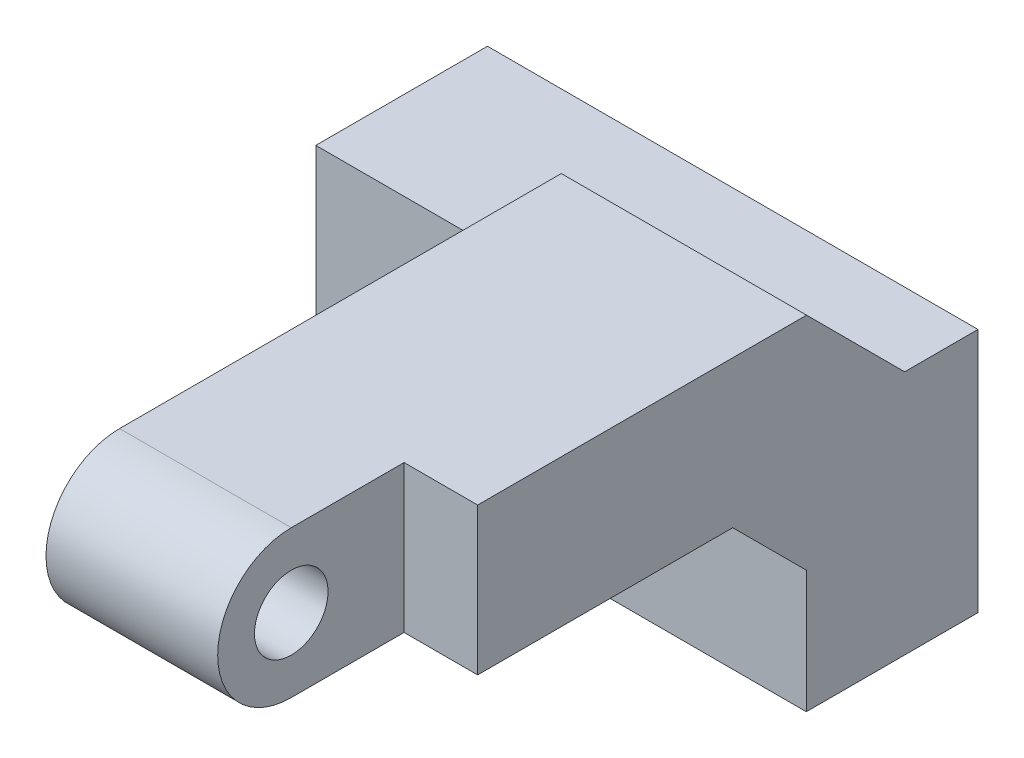
from build123d import *

# Parameters (mm, degrees)
ESQUISSE1_W                  = 20
ESQUISSE1_H                  = 7
BOSS_EXTRU_1_DEPTH           = 10
BOSS_EXTRU_2_DEPTH           = 10
ESQUISSE3_W                  = 3
ESQUISSE3_H                  = 9.2
ENL_V_MAT_EXTRU_1_DEPTH      = 30.93743476
ESQUISSE4_R                  = 1.5
ENL_V_MAT_EXTRU_2_DEPTH      = 30.93743476
ENL_V_MAT_EXTRU_4_DEPTH      = 28.147743921
ENL_V_MAT_EXTRU_4_DEPTH_BACK = 28.147743921
ESQUISSE7_R                  = 1.5
ENL_V_MAT_EXTRU_3_DEPTH      = 28.147743921
ENL_V_MAT_EXTRU_3_DEPTH_BACK = 3.5


with BuildPart() as part:
    # Esquisse1 → Boss.-Extru.1 (new body)
    with BuildSketch(Plane(origin=(0, 0, 0), x_dir=(1, 0, 0), z_dir=(0, 1, 0))):
        Rectangle(ESQUISSE1_W, ESQUISSE1_H)
    extrude(amount=BOSS_EXTRU_1_DEPTH)

    # Esquisse2 → Boss.-Extru.2 (add)
    with BuildSketch(Plane(origin=(0, 0, 0), x_dir=(0, 0, -1), z_dir=(1, 0, 0))):
        with BuildLine():
            Line((-3.5, 5), (-3.5, 10))
            Line((-3.5, 10), (0.510302645, 10))
            Line((0.510302645, 10), (-3.489697355, 14))
            Line((-3.489697355, 14), (-21.5, 14))
            ThreePointArc((-21.5, 14), (-24.5, 11), (-21.5, 8))
            Line((-21.5, 8), (-6.5, 8))
            Line((-6.5, 8), (-3.5, 5))
        make_face()
    extrude(amount=BOSS_EXTRU_2_DEPTH)

    # Esquisse3 → Enlèv. mat.-Extru.1 (cut, through all)
    with BuildSketch(Plane(origin=(0, 14, 0), x_dir=(1, 0, 0), z_dir=(0, 1, 0))):
        with Locations((8.5, -21.5)):
            Rectangle(ESQUISSE3_W, ESQUISSE3_H)
    extrude(amount=-ENL_V_MAT_EXTRU_1_DEPTH, mode=Mode.SUBTRACT)

    # Esquisse4 → Enlèv. mat.-Extru.2 (cut, through all)
    with BuildSketch(Plane.ZY):
        with Locations((21.5, 11)):
            Circle(ESQUISSE4_R)
    extrude(amount=-ENL_V_MAT_EXTRU_2_DEPTH, mode=Mode.SUBTRACT)

    # Esquisse7 → Enlèv. mat.-Extru.4 (cut, two sides: drawn at the far end of the back side and taken through both)
    with BuildSketch(Plane.XY.offset(3.5).offset(-ENL_V_MAT_EXTRU_4_DEPTH_BACK)):
        with Locations((0, 4)):
            Circle(ESQUISSE7_R)
    extrude(amount=ENL_V_MAT_EXTRU_4_DEPTH + ENL_V_MAT_EXTRU_4_DEPTH_BACK, mode=Mode.SUBTRACT)

    # Esquisse5 → Enlèv. mat.-Extru.3 (cut, two sides: drawn at the far end of the back side and taken through both)
    with BuildSketch(Plane.XY.offset(3.5).offset(-ENL_V_MAT_EXTRU_3_DEPTH_BACK)):
        Polygon((-1.58771324, 6.75), (-3.175426481, 4), (-1.58771324, 1.25), (1.58771324, 1.25), (3.175426481, 4), (1.58771324, 6.75), align=None)
    extrude(amount=ENL_V_MAT_EXTRU_3_DEPTH + ENL_V_MAT_EXTRU_3_DEPTH_BACK, mode=Mode.SUBTRACT)


solid = part.part
